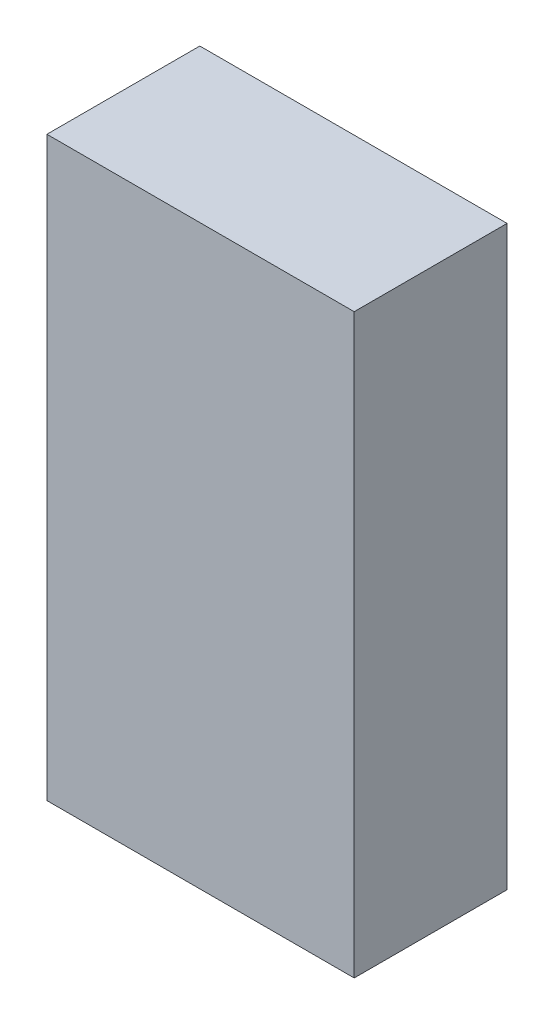
from build123d import *

# Parameters (mm, degrees)
SKETCH1_W           = 20.4
SKETCH1_H           = 77
BOSS_EXTRUDE1_DEPTH = 41


with BuildPart() as part:
    # Sketch1 → Boss-Extrude1 (new body)
    with BuildSketch(Plane(origin=(-66.3, 0, 0), x_dir=(0, 0, -1), z_dir=(1, 0, 0))):
        with Locations((40.5, 0)):
            Rectangle(SKETCH1_W, SKETCH1_H)
    extrude(amount=BOSS_EXTRUDE1_DEPTH)


solid = part.part
